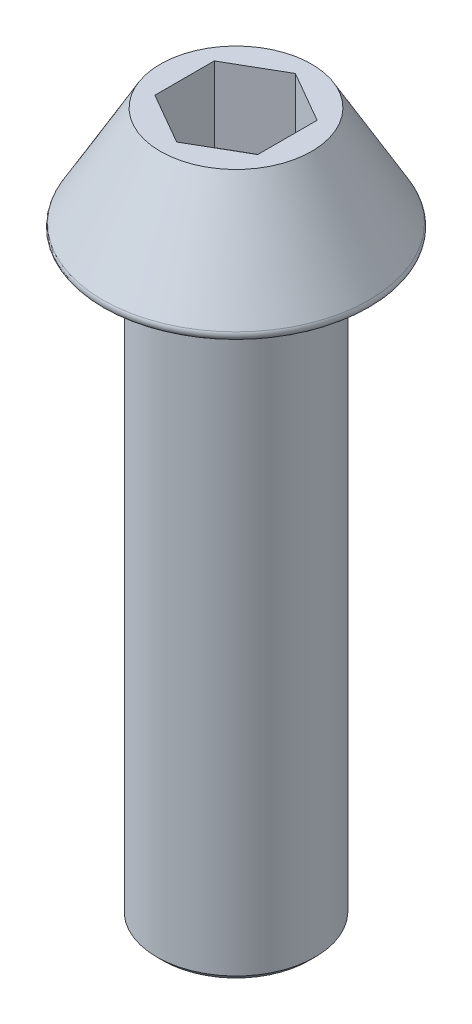
from build123d import *

# Parameters (mm, degrees)
SKETCH1_R           = 4
BOSS_EXTRUDE1_DEPTH = 30
SKETCH2_R           = 7
BOSS_EXTRUDE2_DEPTH = 5.5
BOSS_EXTRUDE2_TAPER = 30
CUT_EXTRUDE1_DEPTH  = 3.8
SKETCH4_R           = 2.65
CUT_EXTRUDE2_DEPTH  = 22
CHAMFER1_SIZE       = 0.3
FILLET1_R           = 0.3


with BuildPart() as part:
    # Sketch1 → Boss-Extrude1 (new body)
    with BuildSketch(Plane(origin=(0, 0, 0), x_dir=(1, 0, 0), z_dir=(0, 1, 0))):
        with Locations(Location((0, 0, 0), (0, 0, 270))):
            Circle(SKETCH1_R)
    extrude(amount=BOSS_EXTRUDE1_DEPTH)

    # Sketch2 → Boss-Extrude2 (add)
    with BuildSketch(Plane(origin=(0, 30, 0), x_dir=(1, 0, 0), z_dir=(0, 1, 0))):
        Circle(SKETCH2_R)
    extrude(amount=BOSS_EXTRUDE2_DEPTH, taper=BOSS_EXTRUDE2_TAPER)

    # Sketch3 → Cut-Extrude1 (cut)
    with BuildSketch(Plane(origin=(0, 35.5, 0), x_dir=(1, 0, 0), z_dir=(0, 1, 0))):
        Polygon((0, 3.0022214), (-2.6, 1.5011107), (-2.6, -1.5011107), (0, -3.0022214), (2.6, -1.5011107), (2.6, 1.5011107), align=None)
    extrude(amount=-CUT_EXTRUDE1_DEPTH, mode=Mode.SUBTRACT)

    # Sketch4 → Cut-Extrude2 (cut)
    with BuildSketch(Plane.XZ):
        with Locations(Location((0, 0, 0), (0, 0, 270))):
            Circle(SKETCH4_R)
    extrude(amount=-CUT_EXTRUDE2_DEPTH, mode=Mode.SUBTRACT)

    # Chamfer1
    chamfer1_edges = [part.edges().sort_by_distance(p)[0] for p in [
        (0, 0, -4),
    ]]
    chamfer(chamfer1_edges, length=CHAMFER1_SIZE)

    # Fillet1
    fillet1_edges = [part.edges().sort_by_distance(p)[0] for p in [
        (-7, 30, 0),
    ]]
    fillet(fillet1_edges, radius=FILLET1_R)


solid = part.part
